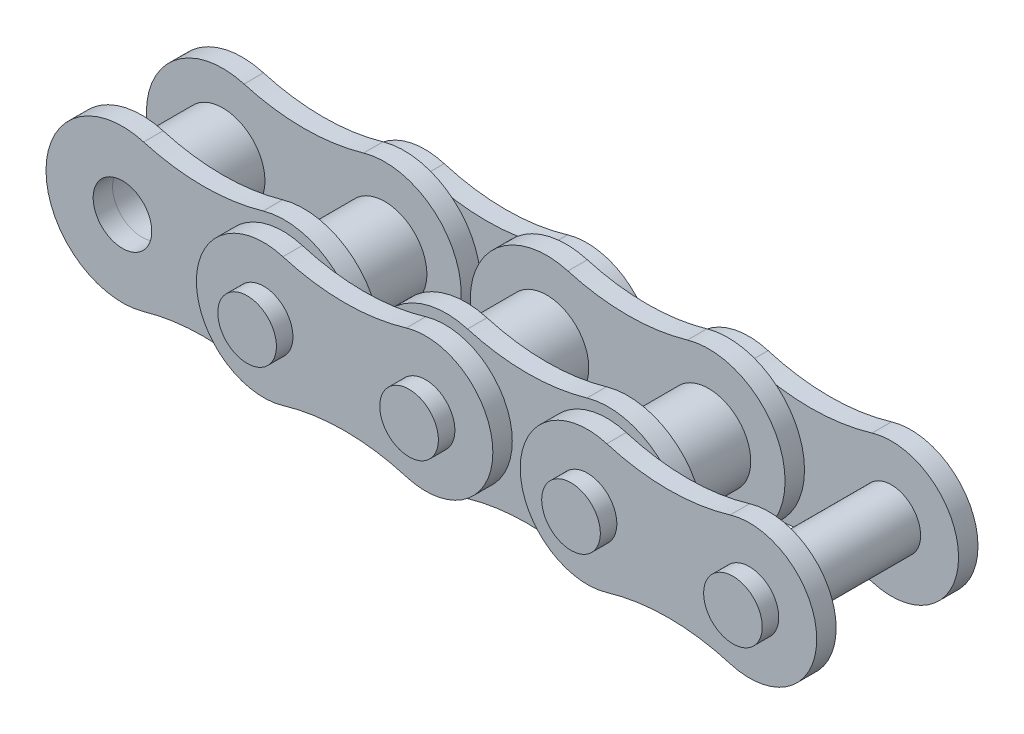
from build123d import *

# Parameters (mm, degrees)
SKETCH4_R                  = 1.651
SKETCH4_R_2                = 1.17475
BOSS_EXTRUDE1_DEPTH        = 1.5875
BOSS_EXTRUDE1_2_DEPTH      = 1.5875
SKETCH5_R                  = 1.14935
BOSS_EXTRUDE2_DEPTH        = 0.762
LPATTERN1_COUNT            = 2
LPATTERN1_PITCH            = 6.35
SKETCH7_R                  = 1.14935
BOSS_EXTRUDE3_DEPTH        = 0.762
BOSS_EXTRUDE4_DEPTH        = 3.81
BOSS_EXTRUDE4_DEPTH_BACK   = 3.81
SKETCH8_R                  = 1.14935
BOSS_EXTRUDE4_2_DEPTH      = 3.81
BOSS_EXTRUDE4_2_DEPTH_BACK = 3.81
LPATTERN2_COUNT            = 2
LPATTERN2_PITCH            = 12.7


with BuildPart() as part:
    # Sketch4 → Boss-Extrude1 (new, symmetric)
    with BuildSketch(Plane.XY):
        with Locations((-3.175, 0)):
            Circle(SKETCH4_R)
        with Locations((-3.175, 0)):
            Circle(SKETCH4_R_2, mode=Mode.SUBTRACT)
    extrude(amount=BOSS_EXTRUDE1_DEPTH, both=True)


with BuildPart() as body_2:
    # Sketch4 → Boss-Extrude1 2 (new, symmetric)
    with BuildSketch(Plane.XY):
        with Locations((3.175, 0)):
            Circle(SKETCH4_R)
        with Locations((3.175, 0)):
            Circle(SKETCH4_R_2, mode=Mode.SUBTRACT)
    extrude(amount=BOSS_EXTRUDE1_2_DEPTH, both=True)


with BuildPart() as body_3:
    # Sketch5 → Boss-Extrude2 (new body)
    with BuildSketch(Plane.XY.offset(1.5875)):
        with BuildLine():
            ThreePointArc((-2.342877482, 2.879371452), (-6.1722, 0), (-2.342877482, -2.879371452))
            ThreePointArc((-2.342877482, -2.879371452), (0, -2.54762), (2.342877482, -2.879371452))
            ThreePointArc((2.342877482, -2.879371452), (6.1722, 0), (2.342877482, 2.879371452))
            ThreePointArc((2.342877482, 2.879371452), (0, 2.54762), (-2.342877482, 2.879371452))
        make_face()
        with Locations(Location((-3.175, 0, 0), (0, 0, 180))):
            Circle(SKETCH5_R, mode=Mode.SUBTRACT)
        with Locations(Location((3.175, 0, 0), (0, 0, 180))):
            Circle(SKETCH5_R, mode=Mode.SUBTRACT)
    extrude(amount=BOSS_EXTRUDE2_DEPTH)


with BuildPart() as lpattern1_1:
    # LPattern1: pattern copy
    add(body_2.part.moved(Location(Vector(1, 0, 0) * (1 * LPATTERN1_PITCH))))


with BuildPart() as body_5:
    # Sketch7 → Boss-Extrude3 (new body)
    with BuildSketch(Plane.XY.offset(-2.4003)):
        with BuildLine():
            ThreePointArc((3.931045679, 2.526853989), (0.537464, 0), (3.931045679, -2.526853989))
            ThreePointArc((3.931045679, -2.526853989), (6.35, -2.17272892), (8.768954321, -2.526853989))
            ThreePointArc((8.768954321, -2.526853989), (12.162536, 0), (8.768954321, 2.526853989))
            ThreePointArc((8.768954321, 2.526853989), (6.35, 2.17272892), (3.931045679, 2.526853989))
        make_face()
        with Locations((3.175, 0)):
            Circle(SKETCH7_R, mode=Mode.SUBTRACT)
        with Locations((9.525, 0)):
            Circle(SKETCH7_R, mode=Mode.SUBTRACT)
    extrude(amount=-BOSS_EXTRUDE3_DEPTH)


with BuildPart() as body_6:
    # Mirror1: mirrored copy
    add(body_3.part.mirror(Plane.XY))


with BuildPart() as body_7:
    # Mirror1 2: mirrored copy
    add(body_5.part.mirror(Plane.XY))


with BuildPart() as body_8:
    # Sketch8 → Boss-Extrude4 (new, two sides: drawn at the far end of the back side and taken through both)
    with BuildSketch(Plane.XY.offset(-BOSS_EXTRUDE4_DEPTH_BACK)):
        with Locations(Location((3.175, 0, 0), (0, 0, 180))):
            Circle(SKETCH8_R)
    extrude(amount=BOSS_EXTRUDE4_DEPTH + BOSS_EXTRUDE4_DEPTH_BACK)


with BuildPart() as body_9:
    # Sketch8 → Boss-Extrude4 2 (new, two sides: drawn at the far end of the back side and taken through both)
    with BuildSketch(Plane.XY.offset(-BOSS_EXTRUDE4_2_DEPTH_BACK)):
        with Locations(Location((9.525, 0, 0), (0, 0, 180))):
            Circle(SKETCH8_R)
    extrude(amount=BOSS_EXTRUDE4_2_DEPTH + BOSS_EXTRUDE4_2_DEPTH_BACK)


with BuildPart() as lpattern2_1:
    # LPattern2: pattern copy
    add(body_9.part.moved(Location(Vector(1, 0, 0) * (1 * LPATTERN2_PITCH))))


with BuildPart() as lpattern2_2:
    # LPattern2: pattern copy
    add(body_8.part.moved(Location(Vector(1, 0, 0) * (1 * LPATTERN2_PITCH))))


with BuildPart() as lpattern2_3:
    # LPattern2: pattern copy
    add(body_7.part.moved(Location(Vector(1, 0, 0) * (1 * LPATTERN2_PITCH))))


with BuildPart() as lpattern2_4:
    # LPattern2: pattern copy
    add(body_6.part.moved(Location(Vector(1, 0, 0) * (1 * LPATTERN2_PITCH))))


with BuildPart() as lpattern2_5:
    # LPattern2: pattern copy
    add(body_5.part.moved(Location(Vector(1, 0, 0) * (1 * LPATTERN2_PITCH))))


with BuildPart() as lpattern2_6:
    # LPattern2: pattern copy
    add(lpattern1_1.part.moved(Location(Vector(1, 0, 0) * (1 * LPATTERN2_PITCH))))


with BuildPart() as lpattern2_7:
    # LPattern2: pattern copy
    add(body_3.part.moved(Location(Vector(1, 0, 0) * (1 * LPATTERN2_PITCH))))


with BuildPart() as lpattern2_8:
    # LPattern2: pattern copy
    add(body_2.part.moved(Location(Vector(1, 0, 0) * (1 * LPATTERN2_PITCH))))


with BuildPart() as lpattern2_9:
    # LPattern2: pattern copy
    add(part.part.moved(Location(Vector(1, 0, 0) * (1 * LPATTERN2_PITCH))))


with BuildPart() as body_2_1:
    add(body_2.part)

    # Combine1: union body 3, LPattern1_1, body 5, body 6, body 7, body 8, body 9, LPattern2_1, LPattern2_2, LPattern2_3, LPattern2_4, LPattern2_5, LPattern2_7, LPattern2_8, LPattern2_9, part
    add(body_3.part)
    add(lpattern1_1.part)
    add(body_5.part)
    add(body_6.part)
    add(body_7.part)
    add(body_8.part)
    add(body_9.part)
    add(lpattern2_1.part)
    add(lpattern2_2.part)
    add(lpattern2_3.part)
    add(lpattern2_4.part)
    add(lpattern2_5.part)
    add(lpattern2_7.part)
    add(lpattern2_8.part)
    add(lpattern2_9.part)
    add(part.part)


solid = body_2_1.part
